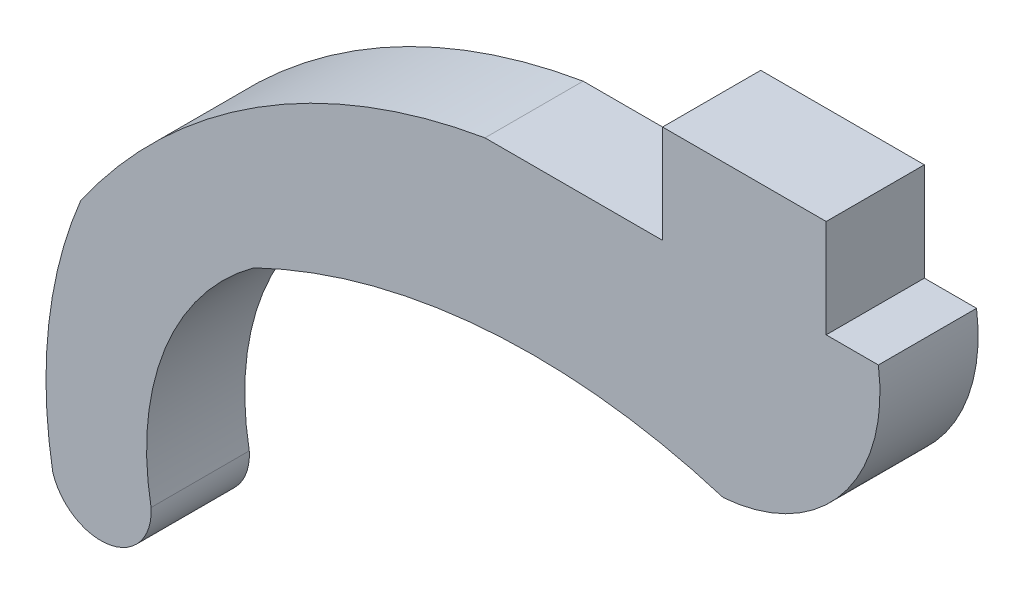
from build123d import *

# Parameters (mm, degrees)
BOSS_EXTRUDE1_DEPTH = 1.524


with BuildPart() as part:
    # Sketch1 → Boss-Extrude1 (new body)
    with BuildSketch(Plane.XY):
        with BuildLine():
            Line((-111.845658384, 0), (-111.845658384, -1.524))
            Line((-111.845658384, -1.524), (-114.602460127, -1.524))
            ThreePointArc((-114.602460127, -1.524), (-118.141425353, -2.883409348), (-120.878346422, -5.506676721))
            ThreePointArc((-120.878346422, -5.506676721), (-121.373374596, -7.40819224), (-121.311747708, -9.372121029))
            ThreePointArc((-121.311747708, -9.372121029), (-120.420802234, -9.907256069), (-119.785228435, -9.084942689))
            ThreePointArc((-119.785228435, -9.084942689), (-119.570544838, -6.84579555), (-118.193770427, -5.066930411))
            ThreePointArc((-118.193770427, -5.066930411), (-114.602460127, -4.096166999), (-110.905453841, -4.510938975))
            ThreePointArc((-110.905453841, -4.510938975), (-109.055147034, -3.538155103), (-108.49557312, -1.524))
            Line((-108.49557312, -1.524), (-109.305658384, -1.524))
            Line((-109.305658384, -1.524), (-109.305658384, 0))
            Line((-109.305658384, 0), (-111.845658384, 0))
        make_face()
    extrude(amount=BOSS_EXTRUDE1_DEPTH)


solid = part.part
